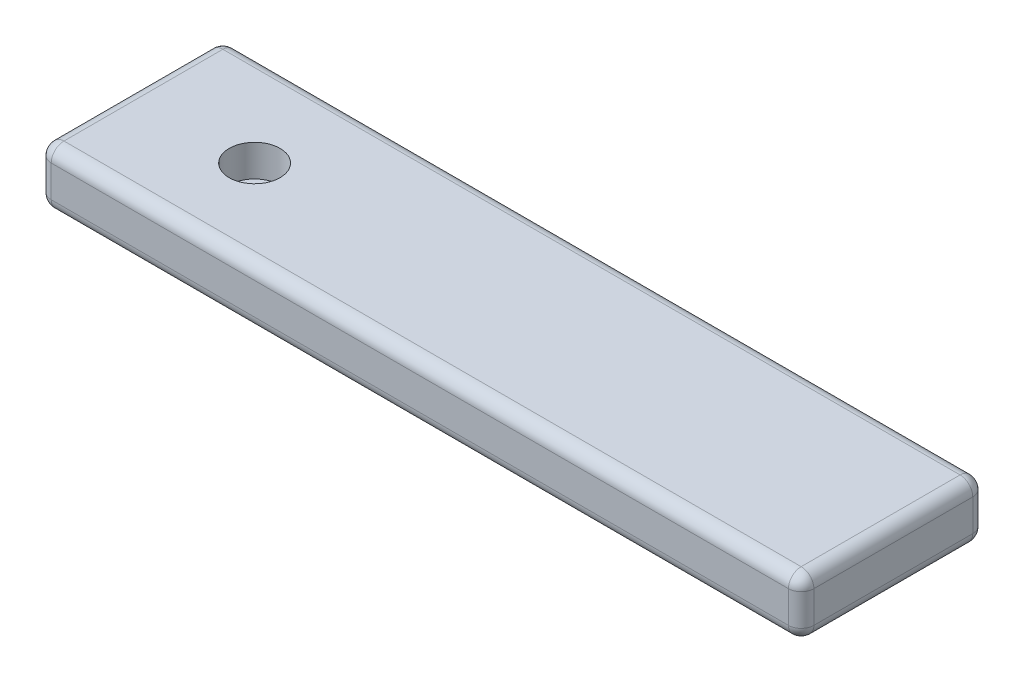
from build123d import *

# Parameters (mm, degrees)
SKETCH1_W           = 18.415
SKETCH1_H           = 5.715
BOSS_EXTRUDE1_DEPTH = 76.2
SKETCH2_R           = 2.54
CUT_EXTRUDE1_DEPTH  = 3.175
FILLET1_R           = 1.27


with BuildPart() as part:
    # Sketch1 → Boss-Extrude1 (new body)
    with BuildSketch(Plane(origin=(0, 0, 0), x_dir=(0, 0, -1), z_dir=(1, 0, 0))):
        with Locations((9.2075, 2.8575)):
            Rectangle(SKETCH1_W, SKETCH1_H)
    extrude(amount=BOSS_EXTRUDE1_DEPTH)

    # Sketch2 → Cut-Extrude1 (cut)
    with BuildSketch(Plane(origin=(0, 5.715, 0), x_dir=(1, 0, 0), z_dir=(0, 1, 0))):
        with Locations(Location((12.7, 8.89, 0), (0, 0, 270))):
            Circle(SKETCH2_R)
    extrude(amount=-CUT_EXTRUDE1_DEPTH, mode=Mode.SUBTRACT)

    # Fillet1
    fillet1_edges = [part.edges().sort_by_distance(p)[0] for p in [
        (76.2, 2.8575, -18.415),
        (76.2, 5.715, -9.2075),
        (76.2, 2.8575, 0),
        (0, 5.715, -9.2075),
        (0, 2.8575, -18.415),
        (0, 0, -9.2075),
        (0, 2.8575, 0),
        (38.1, 5.715, 0),
        (38.1, 5.715, -18.415),
        (38.1, 0, -18.415),
        (38.1, 0, 0),
        (76.2, 0, -9.2075),
    ]]
    fillet(fillet1_edges, radius=FILLET1_R)


solid = part.part
